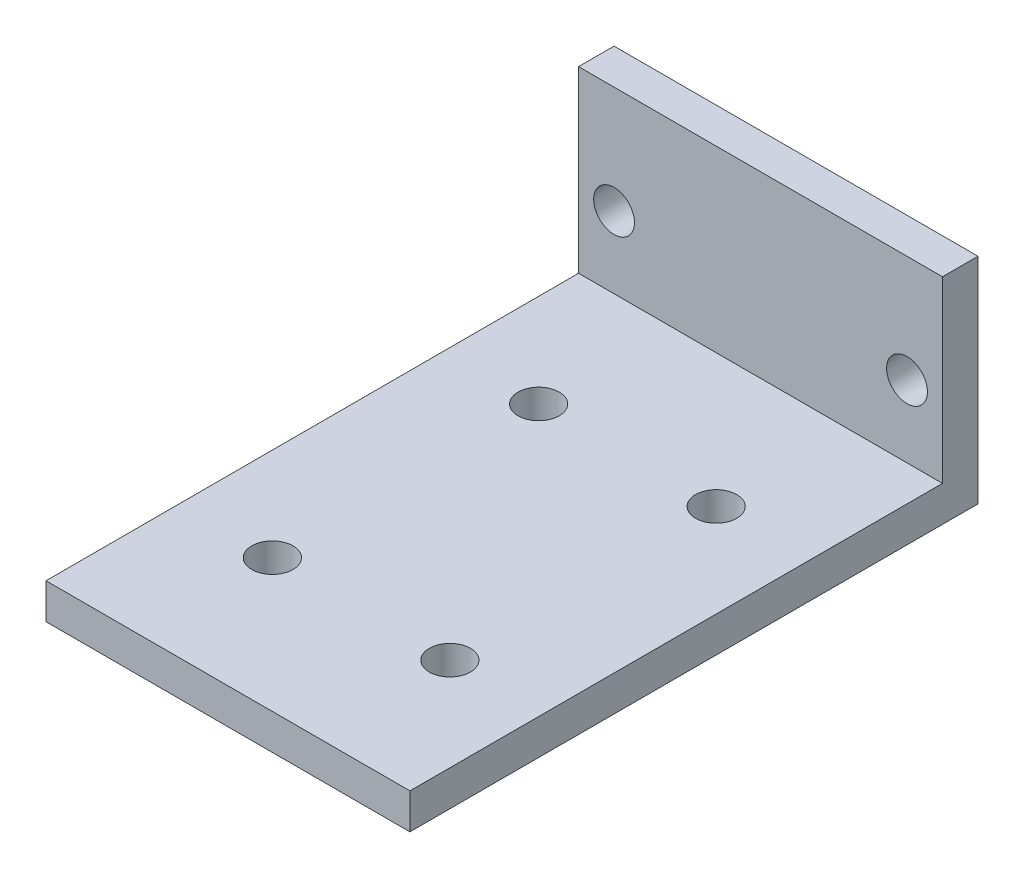
from build123d import *

# Parameters (mm, degrees)
SKETCH2_W                 = 26.035
SKETCH2_H                 = 15.3416
SKETCH2_R                 = 1.4605
BOSS_EXTRUDE1_DEPTH       = 2.54
SKETCH3_W                 = 26.035
SKETCH3_H                 = 2.54
BOSS_EXTRUDE2_DEPTH       = 38.1
F_4_CLEARANCE_HOLE1_D     = 2.9464
F_4_CLEARANCE_HOLE1_DEPTH = 7.62
F_4_CLEARANCE_HOLE1_TIP   = 0.885187864


with BuildPart() as part:
    # Sketch2 → Boss-Extrude1 (new body)
    with BuildSketch(Plane.XY):
        Rectangle(SKETCH2_W, SKETCH2_H)
        with Locations((-10.4775, 0)):
            Circle(SKETCH2_R, mode=Mode.SUBTRACT)
        with Locations((10.4775, 0)):
            Circle(SKETCH2_R, mode=Mode.SUBTRACT)
    extrude(amount=BOSS_EXTRUDE1_DEPTH)

    # Sketch3 → Boss-Extrude2 (add)
    with BuildSketch(Plane.XY.offset(2.54)):
        with Locations((0, -6.4008)):
            Rectangle(SKETCH3_W, SKETCH3_H)
    extrude(amount=BOSS_EXTRUDE2_DEPTH)

    # #4 Clearance Hole1
    with Locations(Plane(origin=(0, -5.1308, 0), x_dir=(1, 0, 0), z_dir=(0, 1, 0))):
        with Locations((-6.35, -12.065), (6.35, -12.065), (-6.35, -31.115), (6.35, -31.115)):
            Hole(F_4_CLEARANCE_HOLE1_D / 2, depth=F_4_CLEARANCE_HOLE1_DEPTH)
            with Locations((0, 0, -(F_4_CLEARANCE_HOLE1_DEPTH + F_4_CLEARANCE_HOLE1_TIP / 2))):  # 118° drill point
                Cone(0, F_4_CLEARANCE_HOLE1_D / 2, F_4_CLEARANCE_HOLE1_TIP, mode=Mode.SUBTRACT)


solid = part.part
